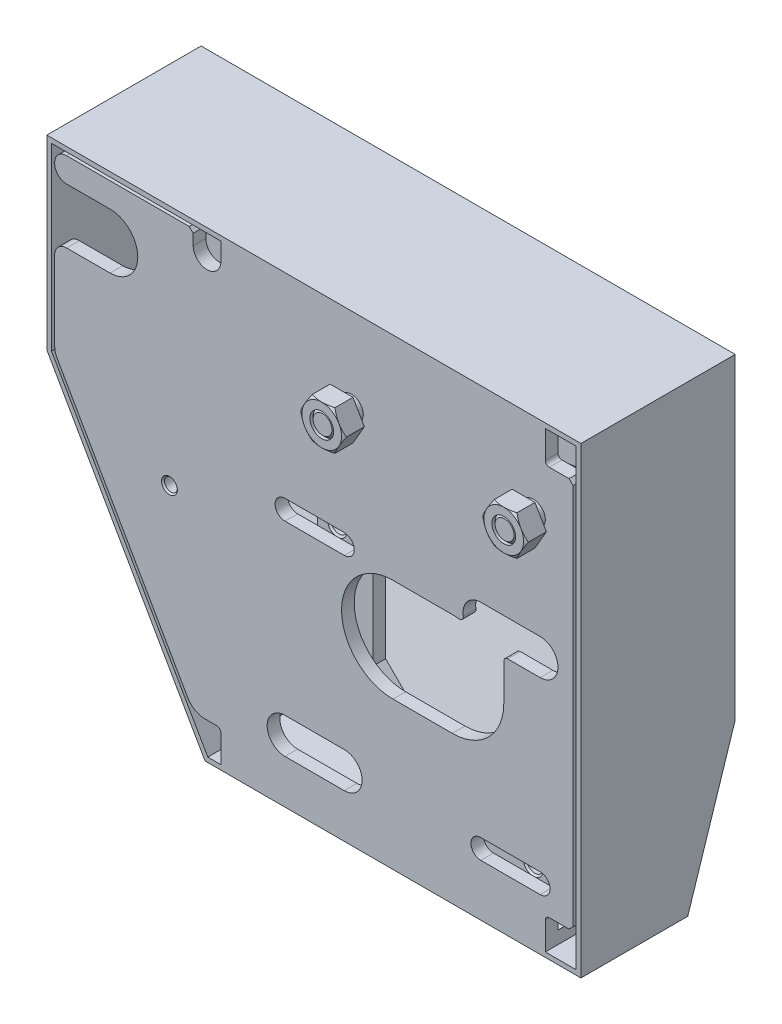
from build123d import *

# Parameters (mm, degrees)
SKETCH_1_W           = 135
SKETCH_1_H           = 117
EXTRUDE_1_DEPTH      = 39
CUT_EXTRUDE_1_DEPTH  = 37.8
EXTRUDE_2_DEPTH      = 135
CUT_EXTRUDE_2_DEPTH  = 135
CUT_EXTRUDE_3_DEPTH  = 39
EXTRUDE_3_DEPTH      = 82
EXTRUDE_4_DEPTH      = 3.2
CUT_EXTRUDE_4_DEPTH  = 3.2
CUT_EXTRUDE_5_DEPTH  = 3.2
CUT_EXTRUDE_6_DEPTH  = 3.2
CUT_EXTRUDE_7_DEPTH  = 3.2
SKETCH_14_R          = 20
CUT_EXTRUDE_8_DEPTH  = 5
CUT_EXTRUDE_9_DEPTH  = 2
SKETCH_17_R          = 20
CUT_EXTRUDE_10_DEPTH = 5
CUT_EXTRUDE_11_DEPTH = 2
EXTRUDE_5_DEPTH      = 20
CUT_EXTRUDE_12_DEPTH = 3.2
CUT_EXTRUDE_13_DEPTH = 3.2
CUT_EXTRUDE_14_DEPTH = 3.2
SKETCH_25_R          = 6
CUT_EXTRUDE_15_DEPTH = 4
EXTRUDE_6_DEPTH      = 3.2
EXTRUDE_7_DEPTH      = 7.5
EXTRUDE_7_DEPTH_BACK = 7.5
CUT_EXTRUDE_16_DEPTH = 3.2


with BuildPart() as part:
    # 草图1 → 凸台-拉伸1 (new body)
    with BuildSketch(Plane.XY):
        with Locations((51.5, -43.3)):
            Rectangle(SKETCH_1_W, SKETCH_1_H)
    extrude(amount=-EXTRUDE_1_DEPTH)

    # 草图2 → 切除-拉伸1 (cut)
    with BuildSketch(Plane.XY):
        Polygon((-14.8, 14), (-14.8, -31.481322676), (24.696387043, -100.6), (117.8, -100.6), (117.8, 14), align=None)
    extrude(amount=-CUT_EXTRUDE_1_DEPTH, mode=Mode.SUBTRACT)

    # 草图3 → 凸台-拉伸2 (add)
    with BuildSketch(Plane(origin=(-16, 0, 0), x_dir=(0, 0, -1), z_dir=(1, 0, 0))):
        Polygon((25.738465924, -101.8), (39, -101.8), (39, -60.910269932), align=None)
    extrude(amount=EXTRUDE_2_DEPTH)

    # 草图4 → 切除-拉伸2 (cut)
    with BuildSketch(Plane(origin=(-16, 0, 0), x_dir=(0, 0, -1), z_dir=(1, 0, 0))):
        Polygon((27, -101.8), (39, -101.8), (39, -64.8), align=None)
    extrude(amount=CUT_EXTRUDE_2_DEPTH, mode=Mode.SUBTRACT)

    # 草图5 → 切除-拉伸3 (cut)
    with BuildSketch(Plane.XY):
        Polygon((-16, -101.8), (24, -101.8), (-16, -31.8), align=None)
    extrude(amount=-CUT_EXTRUDE_3_DEPTH, mode=Mode.SUBTRACT)

    # 草图6 → 凸台-拉伸3 (add)
    with BuildSketch(Plane(origin=(28, 0, 0), x_dir=(0, 0, -1), z_dir=(1, 0, 0))):
        Polygon((0, 14), (0, -100.6), (18, -100.6), (18, -97.4), (3.2, -97.4), (3.2, 10.8), (18, 10.8), (18, 14), align=None)
    extrude(amount=EXTRUDE_3_DEPTH)

    # 草图7 → 凸台-拉伸4 (add)
    with BuildSketch(Plane.XY):
        with BuildLine():
            Line((-13.341215711, -32.421743632), (19.606756323, -90.080694692))
            ThreePointArc((19.606756323, -90.080694692), (21.438337943, -91.924550466), (23.947972034, -92.6))
            Line((23.947972034, -92.6), (27, -92.6))
            ThreePointArc((27, -92.6), (27.707106781, -92.892893219), (28, -93.6))
            Line((28, -93.6), (28, -100.6))
            Line((28, -100.6), (110, -100.6))
            Line((110, -100.6), (110, -93.6))
            ThreePointArc((110, -93.6), (110.292893219, -92.892893219), (111, -92.6))
            Line((111, -92.6), (116, -92.6))
            Line((116, -92.6), (117, -91.6))
            Line((117, -91.6), (117, 5))
            Line((117, 5), (116, 6))
            Line((116, 6), (111, 6))
            ThreePointArc((111, 6), (110.292893219, 6.292893219), (110, 7))
            Line((110, 7), (110, 14))
            Line((110, 14), (28, 14))
            Line((28, 14), (28, 9.5))
            ThreePointArc((28, 9.5), (24.5, 6), (21, 9.5))
            Line((21, 9.5), (21, 12.2))
            Line((21, 12.2), (20, 13.2))
            Line((20, 13.2), (-11, 13.2))
            ThreePointArc((-11, 13.2), (-13.121320344, 12.321320344), (-14, 10.2))
            Line((-14, 10.2), (-14, 10))
            ThreePointArc((-14, 10), (-13.121320344, 7.878679656), (-11, 7))
            Line((-11, 7), (0, 7))
            ThreePointArc((0, 7), (7, 0), (0, -7))
            Line((0, -7), (-11, -7))
            ThreePointArc((-11, -7), (-13.121320344, -7.878679656), (-14, -10))
            Line((-14, -10), (-14, -29.94104894))
            ThreePointArc((-14, -29.94104894), (-13.832498244, -31.224388616), (-13.341215711, -32.421743632))
        make_face()
    extrude(amount=-EXTRUDE_4_DEPTH)

    # 草图8 → 切除-拉伸4 (cut)
    with BuildSketch(Plane.XY):
        with BuildLine():
            Line((71.5, -64.5), (86.5, -64.5))
            ThreePointArc((86.5, -64.5), (95.692388155, -60.692388155), (99.5, -51.5))
            Line((99.5, -51.5), (99.5, -42.2))
            ThreePointArc((99.5, -42.2), (99.792893219, -41.492893219), (100.5, -41.2))
            Line((100.5, -41.2), (108.7, -41.2))
            ThreePointArc((108.7, -41.2), (113.2, -36.7), (108.7, -32.2))
            Line((108.7, -32.2), (93.7, -32.2))
            ThreePointArc((93.7, -32.2), (90.264010521, -33.794147922), (89.262454592, -37.447121644))
            ThreePointArc((89.262454592, -37.447121644), (88.997292866, -38.306125901), (88.149452373, -38.60506662))
            ThreePointArc((88.149452373, -38.60506662), (87.326397623, -38.526293245), (86.5, -38.5))
            Line((86.5, -38.5), (71.5, -38.5))
            ThreePointArc((71.5, -38.5), (58.5, -51.5), (71.5, -64.5))
        make_face()
    extrude(amount=-CUT_EXTRUDE_4_DEPTH, mode=Mode.SUBTRACT)

    # 草图9 → 切除-拉伸5 (cut)
    with BuildSketch(Plane.XY):
        with BuildLine():
            Line((44.2, -90.7), (59.2, -90.7))
            ThreePointArc((59.2, -90.7), (63.7, -86.2), (59.2, -81.7))
            Line((59.2, -81.7), (44.2, -81.7))
            ThreePointArc((44.2, -81.7), (39.7, -86.2), (44.2, -90.7))
        make_face()
    extrude(amount=-CUT_EXTRUDE_5_DEPTH, mode=Mode.SUBTRACT)

    # 草图10 → 切除-拉伸6 (cut)
    with BuildSketch(Plane.XY):
        with BuildLine():
            Line((44.2, -39.2), (59.2, -39.2))
            ThreePointArc((59.2, -39.2), (61.7, -36.7), (59.2, -34.2))
            Line((59.2, -34.2), (44.2, -34.2))
            ThreePointArc((44.2, -34.2), (41.7, -36.7), (44.2, -39.2))
        make_face()
    extrude(amount=-CUT_EXTRUDE_6_DEPTH, mode=Mode.SUBTRACT)

    # 草图11 → 切除-拉伸7 (cut)
    with BuildSketch(Plane.XY):
        with BuildLine():
            Line((93.7, -88.7), (108.7, -88.7))
            ThreePointArc((108.7, -88.7), (111.2, -86.2), (108.7, -83.7))
            Line((108.7, -83.7), (93.7, -83.7))
            ThreePointArc((93.7, -83.7), (91.2, -86.2), (93.7, -88.7))
        make_face()
    extrude(amount=-CUT_EXTRUDE_7_DEPTH, mode=Mode.SUBTRACT)

    # 草图12 → 切除-旋转1 (revolve, cut)
    with BuildSketch(Plane(origin=(15, 0, 0), x_dir=(0, 0, -1), z_dir=(1, 0, 0))):
        Polygon((0, -46), (0, -44), (0.379, -44.379), (2.821, -44.379), (3.2, -44), (3.2, -46), align=None)
    revolve(axis=Axis((15, -46, -3.2), (0, 0, 1)), mode=Mode.SUBTRACT)

    # 草图13 → 旋转1 (revolve)
    with BuildSketch(Plane(origin=(0, -6, 0), x_dir=(1, 0, 0), z_dir=(0, 1, 0))):
        Polygon((61, 10.7), (65.7, 10.7), (66, 10.4), (66, 4.7), (67.1, 4.7), (67.1, 3.2), (64, 3.2), (64, -2.5), (74.660254038, -2.5), (66, -7.5), (64, -7.5), (64, -6.6865), (63.3865, -7.3), (61, -7.3), align=None)
    revolve(axis=Axis((61, -6, 7.3), (0, 0, -1)))

    # 草图14 → 切除-拉伸8 (cut)
    with BuildSketch(Plane.XY.offset(7.5)):
        with Locations((61, -6)):
            Circle(SKETCH_14_R)
        Polygon((55.226497308, -6), (58.113248654, -11), (63.886751346, -11), (66.773502692, -6), (63.886751346, -1), (58.113248654, -1), align=None, mode=Mode.SUBTRACT)
    extrude(amount=-CUT_EXTRUDE_8_DEPTH, mode=Mode.SUBTRACT)

    # 草图15 → 切除-拉伸9 (cut)
    with BuildSketch(Plane(origin=(0, 0, -10.7), x_dir=(-1, 0, 0), z_dir=(0, 0, -1))):
        Polygon((-58.5, -7.443375673), (-58.5, -4.556624327), (-61, -3.113248654), (-63.5, -4.556624327), (-63.5, -7.443375673), (-61, -8.886751346), align=None)
    extrude(amount=-CUT_EXTRUDE_9_DEPTH, mode=Mode.SUBTRACT)

    # 草图16 → 旋转2 (revolve)
    with BuildSketch(Plane(origin=(0, -6, 0), x_dir=(1, 0, 0), z_dir=(0, 1, 0))):
        Polygon((107, 10.7), (111.7, 10.7), (112, 10.4), (112, 4.7), (113.1, 4.7), (113.1, 3.2), (110, 3.2), (110, -2.5), (120.660254038, -2.5), (112, -7.5), (110, -7.5), (110, -6.6865), (109.3865, -7.3), (107, -7.3), align=None)
    revolve(axis=Axis((107, -6, 7.3), (0, 0, -1)))

    # 草图17 → 切除-拉伸10 (cut)
    with BuildSketch(Plane.XY.offset(7.5)):
        with Locations((107, -6)):
            Circle(SKETCH_17_R)
        Polygon((101.226497308, -6), (104.113248654, -11), (109.886751346, -11), (112.773502692, -6), (109.886751346, -1), (104.113248654, -1), align=None, mode=Mode.SUBTRACT)
    extrude(amount=-CUT_EXTRUDE_10_DEPTH, mode=Mode.SUBTRACT)

    # 草图18 → 切除-拉伸11 (cut)
    with BuildSketch(Plane(origin=(0, 0, -10.7), x_dir=(-1, 0, 0), z_dir=(0, 0, -1))):
        Polygon((-104.5, -7.443375673), (-104.5, -4.556624327), (-107, -3.113248654), (-109.5, -4.556624327), (-109.5, -7.443375673), (-107, -8.886751346), align=None)
    extrude(amount=-CUT_EXTRUDE_11_DEPTH, mode=Mode.SUBTRACT)

    # 草图19 → 凸台-拉伸5 (add)
    with BuildSketch(Plane(origin=(0, -57.5, 0), x_dir=(1, 0, 0), z_dir=(0, 1, 0))):
        Polygon((12.2, 3.2), (32.2, 3.2), (32.2, 21.2), (29, 21.2), (29, 6.4), (12.2, 6.4), align=None)
    extrude(amount=-EXTRUDE_5_DEPTH)

    # 草图20 → 切除-拉伸12 (cut)
    with BuildSketch(Plane.ZY.offset(-29)):
        Polygon((-23.2, -55.5), (-23.2, -79.5), (-19.2, -79.5), (-19.2, -77.5), (-21.2, -75.5), (-21.2, -59.5), (-19.2, -57.5), (-19.2, -55.5), align=None)
    extrude(amount=-CUT_EXTRUDE_12_DEPTH, mode=Mode.SUBTRACT)

    # 草图21 → 切除-拉伸13 (cut)
    with BuildSketch(Plane(origin=(0, 0, -6.4), x_dir=(-1, 0, 0), z_dir=(0, 0, -1))):
        Polygon((-12.2, -57.5), (-16.2, -57.5), (-12.2, -61.5), align=None)
    extrude(amount=-CUT_EXTRUDE_13_DEPTH, mode=Mode.SUBTRACT)

    # 草图22 → 切除-拉伸14 (cut)
    with BuildSketch(Plane(origin=(0, 0, -6.4), x_dir=(-1, 0, 0), z_dir=(0, 0, -1))):
        Polygon((-12.2, -77.5), (-12.2, -73.5), (-16.2, -77.5), align=None)
    extrude(amount=-CUT_EXTRUDE_14_DEPTH, mode=Mode.SUBTRACT)

    # 草图23 → 旋转3 (revolve)
    with BuildSketch(Plane.XY.offset(-15.2)):
        Polygon((14.25, -67.5), (14.25, -63.55), (14.55, -63.25), (19.25, -63.25), (19.25, -65), (43.7595, -65), (44.25, -65.4905), (44.25, -67.5), align=None)
    revolve(axis=Axis((44.25, -67.5, -15.2), (-1, 0, 0)))

    # 草图24 → 旋转4 (revolve)
    with BuildSketch(Plane.XY.offset(-15.2)):
        Polygon((25, -67.5), (25, -63.5), (26.154700538, -61.5), (29, -61.5), (29, -67.5), align=None)
    revolve(axis=Axis((29, -67.5, -15.2), (-1, 0, 0)))

    # 草图25 → 切除-拉伸15 (cut)
    with BuildSketch(Plane.ZY.offset(-29)):
        with Locations((-15.2, -67.5)):
            Circle(SKETCH_25_R)
        Polygon((-19.2, -65.190598923), (-19.2, -69.809401077), (-15.2, -72.118802154), (-11.2, -69.809401077), (-11.2, -65.190598923), (-15.2, -62.881197846), align=None, mode=Mode.SUBTRACT)
    extrude(amount=CUT_EXTRUDE_15_DEPTH, mode=Mode.SUBTRACT)

    # 草图26 → 凸台-拉伸6 (add)
    with BuildSketch(Plane.XY.offset(-3.2)):
        Polygon((49.25, -33), (49.25, -76.5), (56.75, -76.5), (72.25, -92), (106.75, -92), (108.75, -90), (108.75, -80), (106.75, -78), (78.25, -78), (63.25, -63), (63.25, -33), (61.25, -31), (51.25, -31), align=None)
    extrude(amount=-EXTRUDE_6_DEPTH)

    # 草图27 → 凸台-拉伸7 (add, two sides: drawn at the far end of the back side and taken through both)
    with BuildSketch(Plane(origin=(0, -69, 0), x_dir=(1, 0, 0), z_dir=(0, 1, 0)).offset(-EXTRUDE_7_DEPTH_BACK)):
        with BuildLine():
            Line((44.25, 21.2), (44.25, 8.2))
            ThreePointArc((44.25, 8.2), (45.714466094, 4.664466094), (49.25, 3.2))
            Line((49.25, 3.2), (49.25, 6.4))
            ThreePointArc((49.25, 6.4), (47.977207794, 6.927207794), (47.45, 8.2))
            Line((47.45, 8.2), (47.45, 21.2))
            Line((47.45, 21.2), (44.25, 21.2))
        make_face()
    extrude(amount=EXTRUDE_7_DEPTH + EXTRUDE_7_DEPTH_BACK)

    # 草图28 → 切除-拉伸16 (cut)
    with BuildSketch(Plane(origin=(47.45, 0, 0), x_dir=(0, 0, -1), z_dir=(1, 0, 0))):
        Polygon((23.2, -78.5), (23.2, -59.5), (19.2, -59.5), (19.2, -61.5), (21.2, -63.5), (21.2, -74.5), (19.2, -76.5), (19.2, -78.5), align=None)
    extrude(amount=-CUT_EXTRUDE_16_DEPTH, mode=Mode.SUBTRACT)

    # 草图29 → 切除-旋转2 (revolve, cut)
    with BuildSketch(Plane(origin=(54.25, 0, 0), x_dir=(0, 0, -1), z_dir=(1, 0, 0))):
        Polygon((3.2, -36.75), (3.2, -34.25), (3.633, -34.683), (5.967, -34.683), (6.4, -34.25), (6.4, -36.75), align=None)
    revolve(axis=Axis((54.25, -36.75, -6.4), (0, 0, 1)), mode=Mode.SUBTRACT)

    # 草图30 → 切除-旋转3 (revolve, cut)
    with BuildSketch(Plane(origin=(103.75, 0, 0), x_dir=(0, 0, -1), z_dir=(1, 0, 0))):
        Polygon((3.2, -86.25), (3.2, -83.75), (3.633, -84.183), (5.967, -84.183), (6.4, -83.75), (6.4, -86.25), align=None)
    revolve(axis=Axis((103.75, -86.25, -6.4), (0, 0, 1)), mode=Mode.SUBTRACT)

    # 草图31 → 旋转5 (revolve)
    with BuildSketch(Plane.XY.offset(-12)):
        with BuildLine():
            Line((36, -101.8), (38.75, -101.8))
            ThreePointArc((38.75, -101.8), (38.313176226, -102.819871458), (37.4, -103.45))
            Line((37.4, -103.45), (36, -103.45))
            Line((36, -103.45), (36, -101.8))
        make_face()
    revolve(axis=Axis((36, -103.45, -12), (0, 1, 0)))

    # 草图32 → 旋转6 (revolve)
    with BuildSketch(Plane.XY.offset(-12)):
        with BuildLine():
            Line((102, -101.8), (104.75, -101.8))
            ThreePointArc((104.75, -101.8), (104.313176226, -102.819871458), (103.4, -103.45))
            Line((103.4, -103.45), (102, -103.45))
            Line((102, -103.45), (102, -101.8))
        make_face()
    revolve(axis=Axis((102, -103.45, -12), (0, 1, 0)))


solid = part.part
